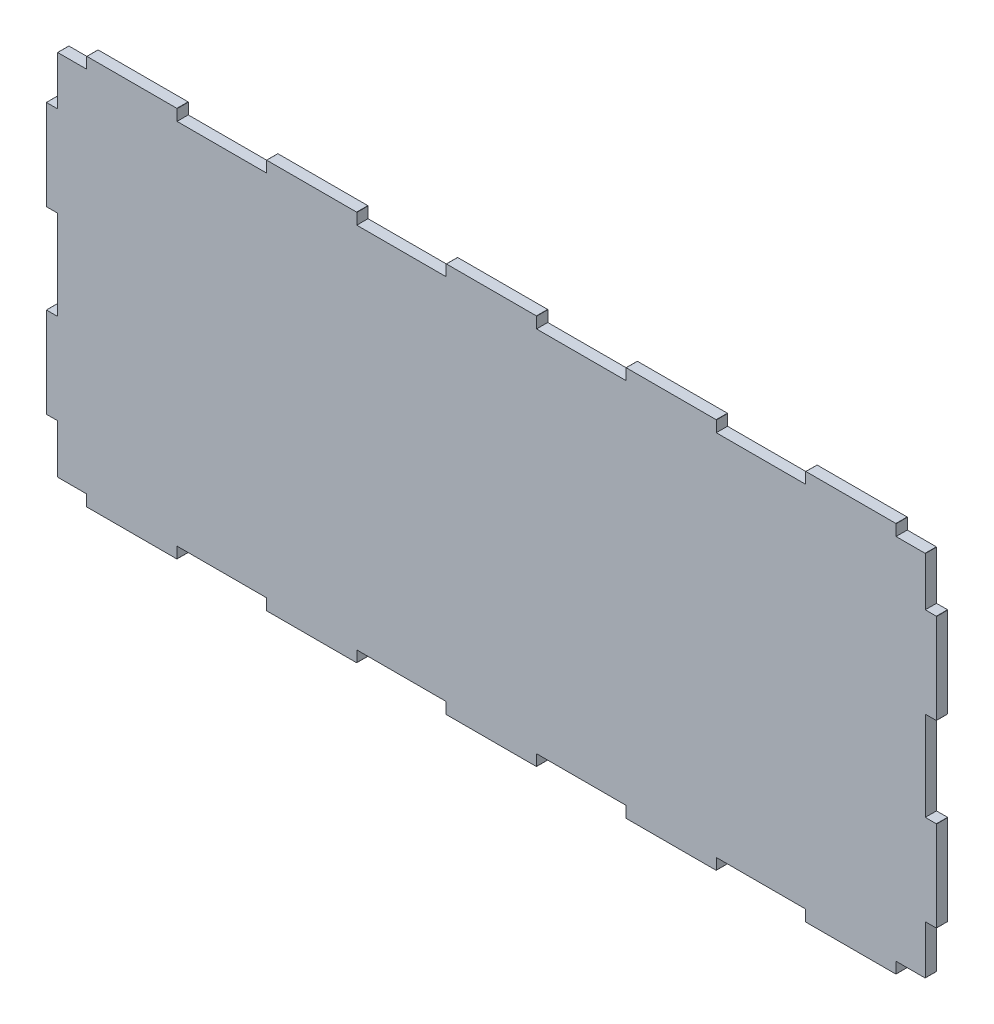
from build123d import *

# Parameters (mm, degrees)
BOSS_EXTRUDE1_DEPTH = 5


with BuildPart() as part:
    # Model → Boss-Extrude1 (new body)
    with BuildSketch(Plane.XY):
        Polygon((-139.94, -86.83), (-139.93, -86.82), (-139.92, -86.8), (-139.91, -86.79), (-139.9, -86.77), (-139.9, -81.85), (-100.1, -81.85), (-100.1, -86.77), (-100.08, -86.81), (-100.07, -86.82), (-100.05, -86.83), (-100.04, -86.84), (-100.02, -86.85), (-59.98, -86.85), (-59.94, -86.83), (-59.93, -86.82), (-59.92, -86.8), (-59.91, -86.79), (-59.9, -86.77), (-59.9, -81.85), (-20.1, -81.85), (-20.1, -86.77), (-20.08, -86.81), (-20.07, -86.82), (-20.05, -86.83), (-20.04, -86.84), (-20.02, -86.85), (20.02, -86.85), (20.06, -86.83), (20.07, -86.82), (20.08, -86.8), (20.09, -86.79), (20.1, -86.77), (20.1, -81.85), (59.9, -81.85), (59.9, -86.77), (59.92, -86.81), (59.93, -86.82), (59.95, -86.83), (59.96, -86.84), (59.98, -86.85), (100.02, -86.85), (100.06, -86.83), (100.07, -86.82), (100.08, -86.8), (100.09, -86.79), (100.1, -86.77), (100.1, -81.85), (139.9, -81.85), (139.9, -86.77), (139.92, -86.81), (139.93, -86.82), (139.95, -86.83), (139.96, -86.84), (139.98, -86.85), (180.02, -86.85), (180.06, -86.83), (180.07, -86.82), (180.08, -86.8), (180.09, -86.79), (180.1, -86.77), (180.1, -81.85), (193.02, -81.85), (193.06, -81.83), (193.07, -81.82), (193.08, -81.8), (193.09, -81.79), (193.1, -81.77), (193.1, -60.1), (198.02, -60.1), (198.06, -60.08), (198.07, -60.07), (198.08, -60.05), (198.09, -60.04), (198.1, -60.02), (198.1, -19.98), (198.08, -19.94), (198.07, -19.93), (198.05, -19.92), (198.04, -19.91), (198.02, -19.9), (193.1, -19.9), (193.1, 19.9), (198.02, 19.9), (198.06, 19.92), (198.07, 19.93), (198.08, 19.95), (198.09, 19.96), (198.1, 19.98), (198.1, 60.02), (198.08, 60.06), (198.07, 60.07), (198.05, 60.08), (198.04, 60.09), (198.02, 60.1), (193.1, 60.1), (193.1, 81.77), (193.08, 81.81), (193.07, 81.82), (193.05, 81.83), (193.04, 81.84), (193.02, 81.85), (180.1, 81.85), (180.1, 86.77), (180.08, 86.81), (180.07, 86.82), (180.05, 86.83), (180.04, 86.84), (180.02, 86.85), (139.98, 86.85), (139.94, 86.83), (139.93, 86.82), (139.92, 86.8), (139.91, 86.79), (139.9, 86.77), (139.9, 81.85), (100.1, 81.85), (100.1, 86.77), (100.08, 86.81), (100.07, 86.82), (100.05, 86.83), (100.04, 86.84), (100.02, 86.85), (59.98, 86.85), (59.94, 86.83), (59.93, 86.82), (59.92, 86.8), (59.91, 86.79), (59.9, 86.77), (59.9, 81.85), (20.1, 81.85), (20.1, 86.77), (20.08, 86.81), (20.07, 86.82), (20.05, 86.83), (20.04, 86.84), (20.02, 86.85), (-20.02, 86.85), (-20.06, 86.83), (-20.07, 86.82), (-20.08, 86.8), (-20.09, 86.79), (-20.1, 86.77), (-20.1, 81.85), (-59.9, 81.85), (-59.9, 86.77), (-59.92, 86.81), (-59.93, 86.82), (-59.95, 86.83), (-59.96, 86.84), (-59.98, 86.85), (-100.02, 86.85), (-100.06, 86.83), (-100.07, 86.82), (-100.08, 86.8), (-100.09, 86.79), (-100.1, 86.77), (-100.1, 81.85), (-139.9, 81.85), (-139.9, 86.77), (-139.92, 86.81), (-139.93, 86.82), (-139.95, 86.83), (-139.96, 86.84), (-139.98, 86.85), (-180.02, 86.85), (-180.06, 86.83), (-180.07, 86.82), (-180.08, 86.8), (-180.09, 86.79), (-180.1, 86.77), (-180.1, 81.85), (-193.02, 81.85), (-193.06, 81.83), (-193.07, 81.82), (-193.08, 81.8), (-193.09, 81.79), (-193.1, 81.77), (-193.1, 60.1), (-198.02, 60.1), (-198.06, 60.08), (-198.07, 60.07), (-198.08, 60.05), (-198.09, 60.04), (-198.1, 60.02), (-198.1, 19.98), (-198.08, 19.94), (-198.07, 19.93), (-198.05, 19.92), (-198.04, 19.91), (-198.02, 19.9), (-193.1, 19.9), (-193.1, -19.9), (-198.02, -19.9), (-198.06, -19.92), (-198.07, -19.93), (-198.08, -19.95), (-198.09, -19.96), (-198.1, -19.98), (-198.1, -60.02), (-198.08, -60.06), (-198.07, -60.07), (-198.05, -60.08), (-198.04, -60.09), (-198.02, -60.1), (-193.1, -60.1), (-193.1, -81.77), (-193.08, -81.81), (-193.07, -81.82), (-193.05, -81.83), (-193.04, -81.84), (-193.02, -81.85), (-180.1, -81.85), (-180.1, -86.77), (-180.08, -86.81), (-180.07, -86.82), (-180.05, -86.83), (-180.04, -86.84), (-180.02, -86.85), (-139.98, -86.85), align=None)
    extrude(amount=BOSS_EXTRUDE1_DEPTH)


solid = part.part
